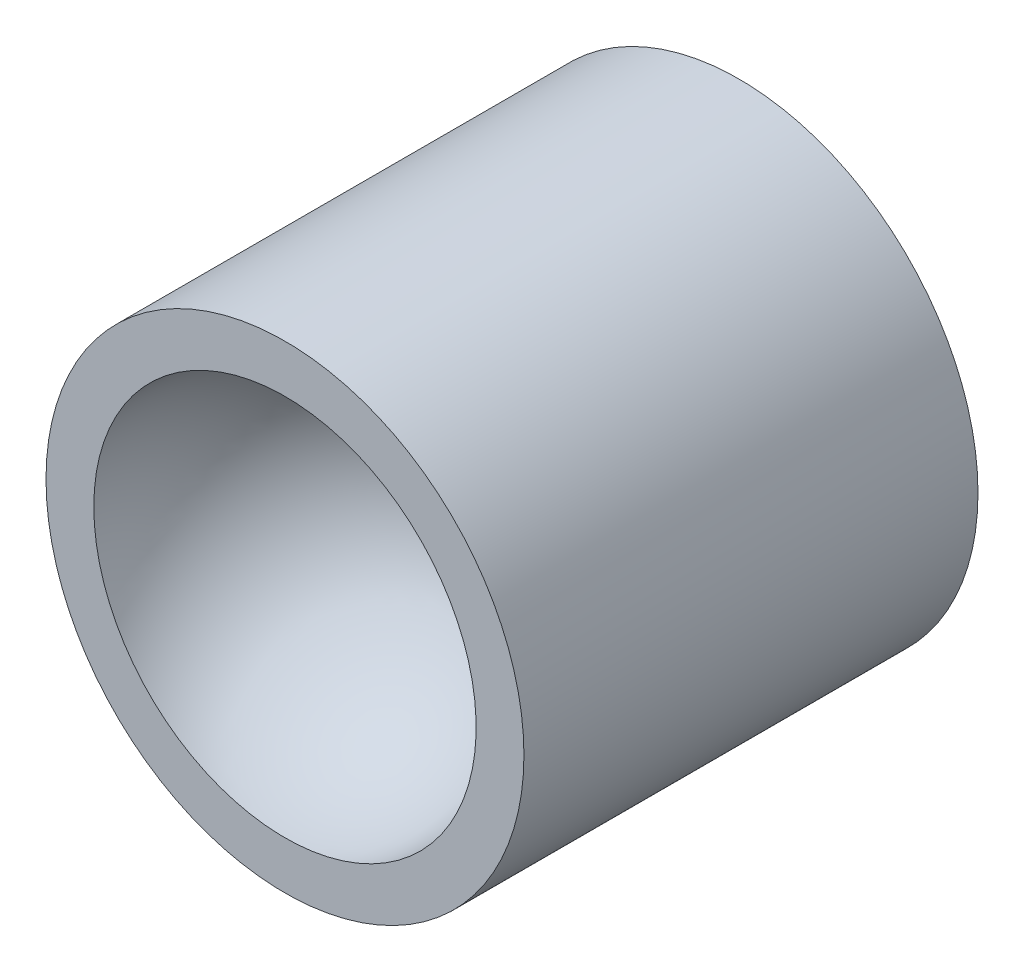
from build123d import *

# Parameters (mm, degrees)
SKETCH2_R          = 1.5
CUT_EXTRUDE1_DEPTH = 8


with BuildPart() as part:
    # Sketch1 → Revolve1 (revolve)
    with BuildSketch(Plane(origin=(0, 0, 0), x_dir=(1, 0, 0), z_dir=(0, 1, 0))):
        with BuildLine():
            Line((-8, 0), (-10, 0))
            Line((-10, 0), (-10, 19))
            Line((-10, 19), (0, 19))
            Line((0, 19), (0, 8))
            ThreePointArc((0, 8), (-5.656854249, 5.656854249), (-8, 0))
        make_face()
    revolve(axis=Axis((0, 0, -19), (0, 0, 1)))

    # Sketch2 → Cut-Extrude1 (cut)
    with BuildSketch(Plane(origin=(0, 0, -19), x_dir=(-1, 0, 0), z_dir=(0, 0, -1))):
        Circle(SKETCH2_R)
    extrude(amount=-CUT_EXTRUDE1_DEPTH, mode=Mode.SUBTRACT)


solid = part.part
